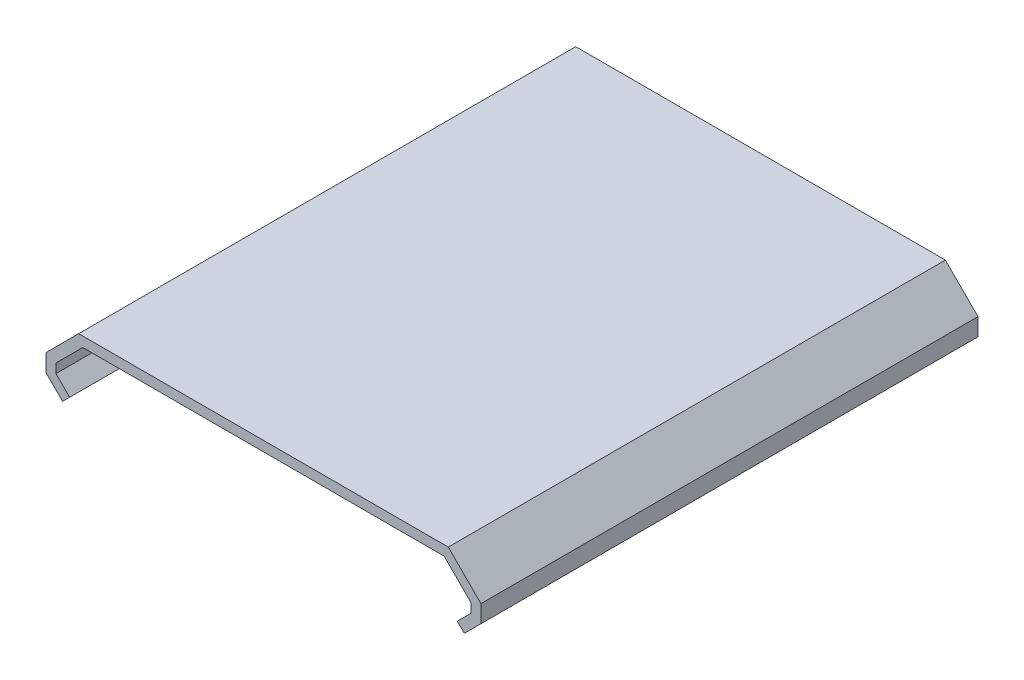
from build123d import *

# Parameters (mm, degrees)
EXTRUDE_1_DEPTH = 200


with BuildPart() as part:
    # 草图1 → 拉伸-薄壁1 (new body)
    with BuildSketch(Plane.XY):
        Polygon((-78, 34.779006664), (-83.5, 40.279006664), (-83.5, 43.986113445), (-72.707106781, 54.779006664), (72.707106781, 54.779006664), (83.5, 43.986113445), (83.5, 40.279006664), (78, 34.779006664), (80.828427125, 31.950579539), (87.5, 38.622152414), (87.5, 45.642967694), (74.363961031, 58.779006664), (-74.363961031, 58.779006664), (-87.5, 45.642967694), (-87.5, 38.622152414), (-80.828427125, 31.950579539), align=None)
    extrude(amount=-EXTRUDE_1_DEPTH)


solid = part.part
